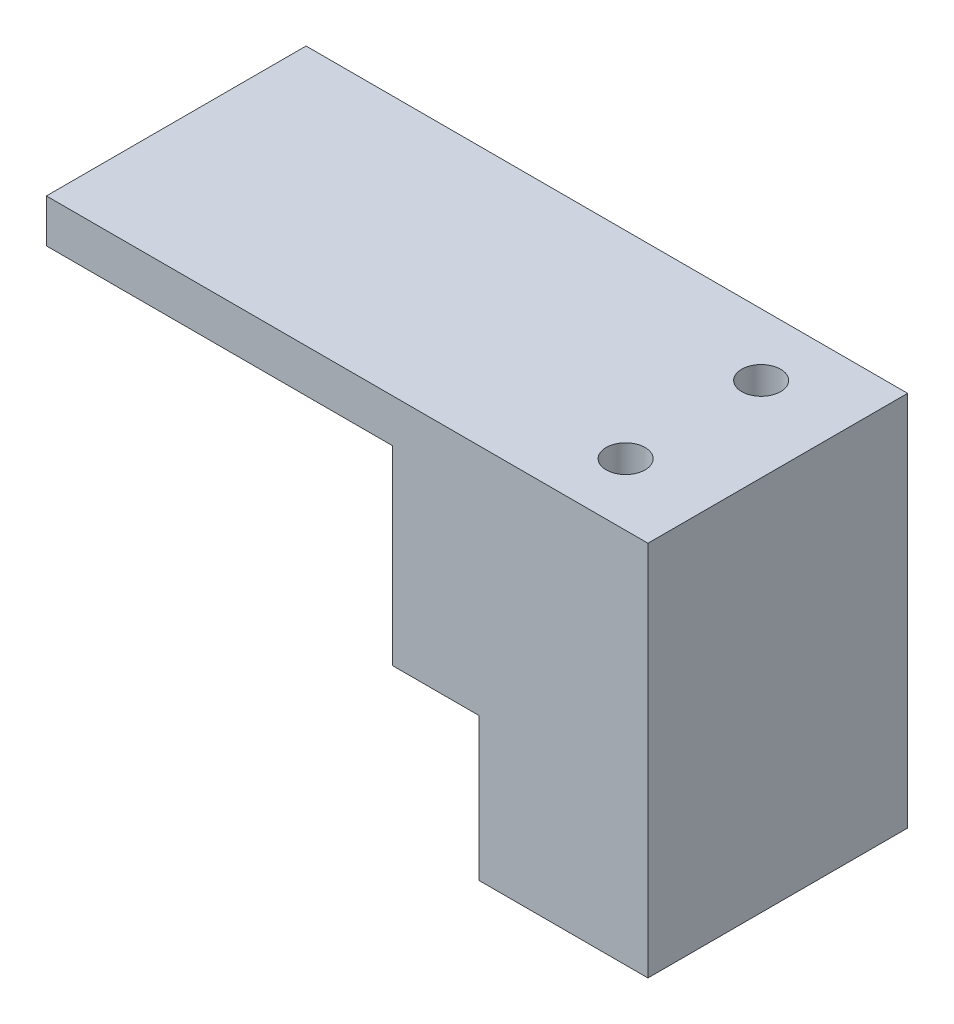
from build123d import *

# Parameters (mm, degrees)
SKETCH1_W           = 19.5
SKETCH1_H           = 30
SKETCH1_R           = 2.25
BOSS_EXTRUDE1_DEPTH = 16.5
SKETCH2_R           = 2.25
BOSS_EXTRUDE2_DEPTH = 22
SKETCH3_R           = 2.25
BOSS_EXTRUDE3_DEPTH = 5


with BuildPart() as part:
    # Sketch1 → Boss-Extrude1 (new body)
    with BuildSketch(Plane(origin=(0, 0, 0), x_dir=(1, 0, 0), z_dir=(0, 1, 0))):
        with Locations((9.75, 15)):
            Rectangle(SKETCH1_W, SKETCH1_H)
        with Locations(Location((9.75, 22.830092663, 0), (0, 0, 270))):
            Circle(SKETCH1_R, mode=Mode.SUBTRACT)
        with Locations(Location((9.75, 7.169907337, 0), (0, 0, 270))):
            Circle(SKETCH1_R, mode=Mode.SUBTRACT)
    extrude(amount=BOSS_EXTRUDE1_DEPTH)

    # Sketch2 → Boss-Extrude2 (add)
    with BuildSketch(Plane(origin=(0, 16.5, 0), x_dir=(1, 0, 0), z_dir=(0, 1, 0))):
        Polygon((0, 30), (-10, 30), (-10, 0), (0, 0), (19.5, 0), (19.5, 30), align=None)
        with Locations(Location((9.75, 22.830092663, 0), (0, 0, 270))):
            Circle(SKETCH2_R, mode=Mode.SUBTRACT)
        with Locations(Location((9.75, 7.169907337, 0), (0, 0, 270))):
            Circle(SKETCH2_R, mode=Mode.SUBTRACT)
    extrude(amount=BOSS_EXTRUDE2_DEPTH)

    # Sketch3 → Boss-Extrude3 (add)
    with BuildSketch(Plane(origin=(0, 38.5, 0), x_dir=(1, 0, 0), z_dir=(0, 1, 0))):
        Polygon((-10, 30), (-50, 30), (-50, 0), (-10, 0), (19.5, 0), (19.5, 30), align=None)
        with Locations(Location((9.75, 22.830092663, 0), (0, 0, 270))):
            Circle(SKETCH3_R, mode=Mode.SUBTRACT)
        with Locations(Location((9.75, 7.169907337, 0), (0, 0, 270))):
            Circle(SKETCH3_R, mode=Mode.SUBTRACT)
    extrude(amount=BOSS_EXTRUDE3_DEPTH)


solid = part.part
